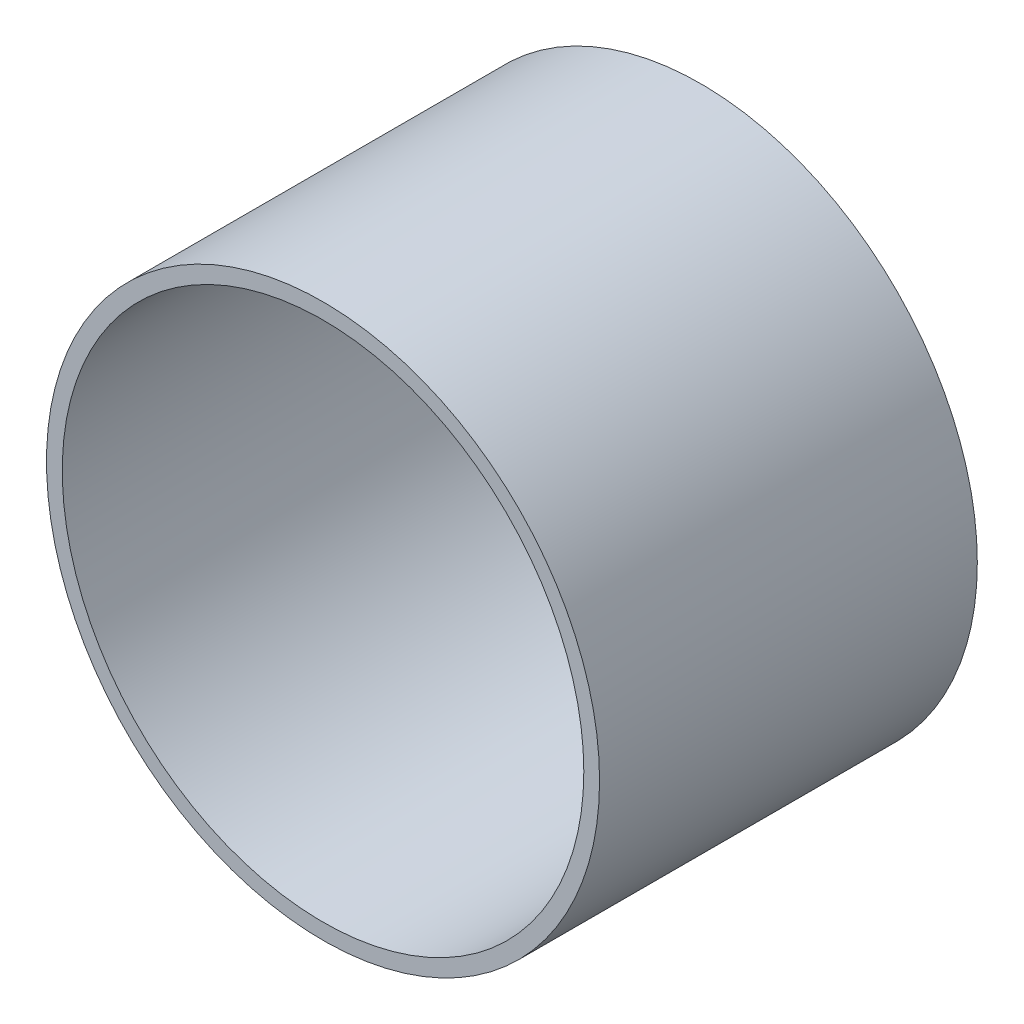
from build123d import *

# Parameters (mm, degrees)
SKETCH1_R           = 50
SKETCH1_R_2         = 47.15
BOSS_EXTRUDE1_DEPTH = 68.3


with BuildPart() as part:
    # Sketch1 → Boss-Extrude1 (new body)
    with BuildSketch(Plane.XY):
        Circle(SKETCH1_R)
        Circle(SKETCH1_R_2, mode=Mode.SUBTRACT)
    extrude(amount=BOSS_EXTRUDE1_DEPTH)


solid = part.part
